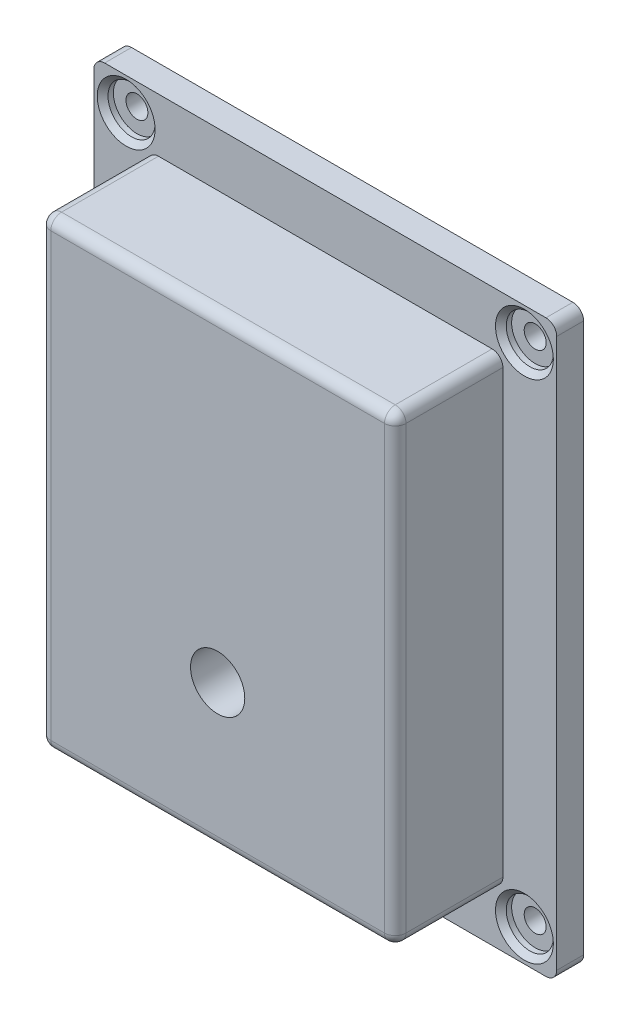
from build123d import *

# Parameters (mm, degrees)
SKETCH2_W                                   = 54.61
SKETCH2_H                                   = 41.91
SKETCH2_W_2                                 = 41.91
SKETCH2_H_2                                 = 29.21
BOSS_EXTRUDE1_DEPTH                         = 9.525
SKETCH4_W                                   = 41.91
SKETCH4_H                                   = 54.61
BOSS_EXTRUDE2_DEPTH                         = 6.35
SKETCH6_R                                   = 3.2004
CUT_EXTRUDE1_DEPTH                          = 63.012553769
SKETCH7_W                                   = 67.31
SKETCH7_H                                   = 54.61
SKETCH7_W_2                                 = 54.61
SKETCH7_H_2                                 = 41.91
BOSS_EXTRUDE3_DEPTH                         = 3.175
CBORE_FOR_2_BINDING_HEAD_MACHINE_SC_2_COUNT = 2
CBORE_FOR_2_BINDING_HEAD_MACHINE_SC_2_PITCH = 46.99
CBORE_FOR_2_BINDING_HEAD_MACHINE_SC_3_COUNT = 2
CBORE_FOR_2_BINDING_HEAD_MACHINE_SC_3_PITCH = 75.966809858
CBORE_FOR_2_BINDING_HEAD_MACHINE_SC_4_COUNT = 2
CBORE_FOR_2_BINDING_HEAD_MACHINE_SC_4_PITCH = 59.69
FILLET1_R                                   = 1.27


with BuildPart() as part:
    # Sketch2 → Boss-Extrude1 (new body)
    with BuildSketch(Plane(origin=(0, 0, 0), x_dir=(0, 1, 0), z_dir=(0, 0, 1))):
        with Locations((20.955, 14.605)):
            Rectangle(SKETCH2_W, SKETCH2_H)
        with Locations((20.955, 14.605)):
            Rectangle(SKETCH2_W_2, SKETCH2_H_2, mode=Mode.SUBTRACT)
    extrude(amount=BOSS_EXTRUDE1_DEPTH)

    # Sketch4 → Boss-Extrude2 (add)
    with BuildSketch(Plane.XY.offset(9.525)):
        with Locations((-14.605, 20.955)):
            Rectangle(SKETCH4_W, SKETCH4_H)
    extrude(amount=BOSS_EXTRUDE2_DEPTH)

    # Sketch6 → Cut-Extrude1 (cut, through all)
    with BuildSketch(Plane.XY.offset(15.875)):
        with Locations((-14.605, 10.668)):
            Circle(SKETCH6_R)
    extrude(amount=-CUT_EXTRUDE1_DEPTH, mode=Mode.SUBTRACT)

    # Sketch7 → Boss-Extrude3 (add)
    with BuildSketch(Plane(origin=(0, 0, 0), x_dir=(0, 1, 0), z_dir=(0, 0, 1))):
        with Locations((20.955, 14.605)):
            Rectangle(SKETCH7_W, SKETCH7_H)
        with Locations((20.955, 14.605)):
            Rectangle(SKETCH7_W_2, SKETCH7_H_2, mode=Mode.SUBTRACT)
    extrude(amount=BOSS_EXTRUDE3_DEPTH)

    # Sketch9 → CBORE for #2 Binding Head Machine Screw1 (revolve, cut)
    with BuildSketch(Plane(origin=(-38.1, 50.8, 3.175), x_dir=(0, -1, 0), z_dir=(1, 0, 0))):
        Polygon((0, 0), (0, 3.175), (1.2954, 3.175), (1.2954, 1.27), (2.77876, 1.27), (2.77876, 0.635), (3.41376, 0), align=None)
    cbore_for_2_binding_head_machine_screw1 = revolve(axis=Axis((-38.1, 50.8, 9.525), (0, 0, -1)), mode=Mode.SUBTRACT)

    # CBORE for _2 Binding Head Machine Sc 2: CBORE for #2 Binding Head Machine Screw1 ×2
    with Locations(*[(i * CBORE_FOR_2_BINDING_HEAD_MACHINE_SC_2_PITCH, 0, 0) for i in range(1, CBORE_FOR_2_BINDING_HEAD_MACHINE_SC_2_COUNT)]):
        add(cbore_for_2_binding_head_machine_screw1, mode=Mode.SUBTRACT)

    # CBORE for _2 Binding Head Machine Sc 3: CBORE for #2 Binding Head Machine Screw1 ×2
    with Locations(*[Vector(0.6185596063312605, -0.7857378783126826, 0) * (i * CBORE_FOR_2_BINDING_HEAD_MACHINE_SC_3_PITCH) for i in range(1, CBORE_FOR_2_BINDING_HEAD_MACHINE_SC_3_COUNT)]):
        add(cbore_for_2_binding_head_machine_screw1, mode=Mode.SUBTRACT)

    # CBORE for _2 Binding Head Machine Sc 4: CBORE for #2 Binding Head Machine Screw1 ×2
    with Locations(*[(0, -i * CBORE_FOR_2_BINDING_HEAD_MACHINE_SC_4_PITCH, 0) for i in range(1, CBORE_FOR_2_BINDING_HEAD_MACHINE_SC_4_COUNT)]):
        add(cbore_for_2_binding_head_machine_screw1, mode=Mode.SUBTRACT)

    # Fillet1
    fillet1_edges = [part.edges().sort_by_distance(p)[0] for p in [
        (-35.56, 20.955, 15.875),
        (-14.605, -6.35, 15.875),
        (6.35, 20.955, 15.875),
        (-14.605, 48.26, 15.875),
        (-41.91, -12.7, 1.5875),
        (12.7, -12.7, 1.5875),
        (12.7, 54.61, 1.5875),
        (-41.91, 54.61, 1.5875),
        (-35.56, -6.35, 9.525),
        (-35.56, 48.26, 9.525),
        (6.35, 48.26, 9.525),
        (6.35, -6.35, 9.525),
    ]]
    fillet(fillet1_edges, radius=FILLET1_R)


solid = part.part
